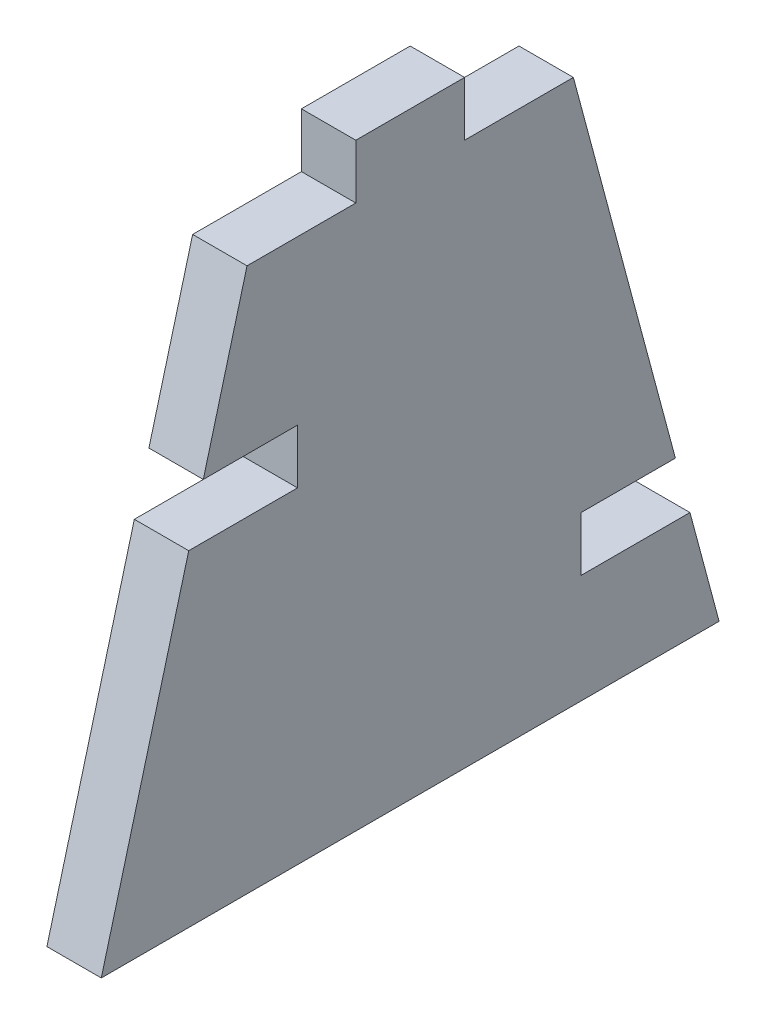
from build123d import *

# Parameters (mm, degrees)
BOSS_EXTRUDE1_DEPTH = 10


with BuildPart() as part:
    # Sketch1 → Boss-Extrude1 (new body)
    with BuildSketch(Plane(origin=(0, 0, 0), x_dir=(0, 0, -1), z_dir=(1, 0, 0))):
        Polygon((56.794919243, 0), (-56.794919243, 0), (-40.717967697, 60), (-20.717967697, 60), (-20.717967697, 70), (-38.038475773, 70), (-30, 100), (-10, 100), (-10, 110), (10, 110), (10, 100), (30, 100), (38.038475773, 70), (40.717967697, 60), (48.75644347, 30), (31.435935394, 30), (31.435935394, 20), (51.435935394, 20), align=None)
    extrude(amount=BOSS_EXTRUDE1_DEPTH)


solid = part.part
